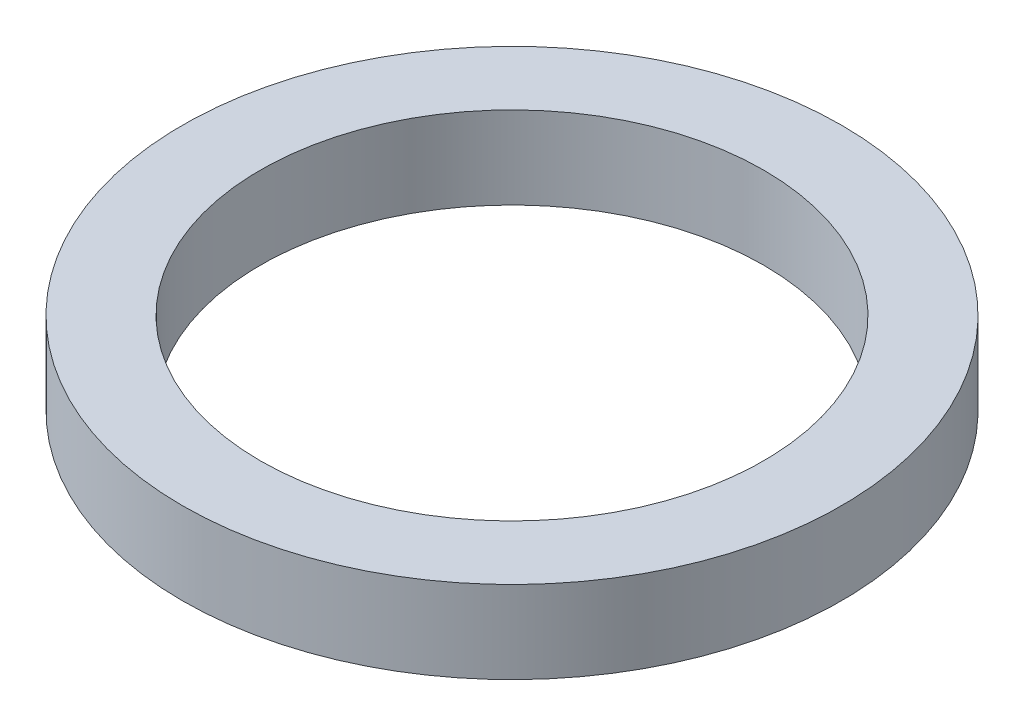
from build123d import *

# Parameters (mm, degrees)
SKETCH1_R           = 36
SKETCH1_R_2         = 27.5
BOSS_EXTRUDE1_DEPTH = 4.5


with BuildPart() as part:
    # Sketch1 → Boss-Extrude1 (new, symmetric)
    with BuildSketch(Plane(origin=(0, 0, 0), x_dir=(1, 0, 0), z_dir=(0, 1, 0))):
        with Locations(Location((0, 0, 0), (0, 0, 270))):
            Circle(SKETCH1_R)
        with Locations(Location((0, 0, 0), (0, 0, 270))):
            Circle(SKETCH1_R_2, mode=Mode.SUBTRACT)
    extrude(amount=BOSS_EXTRUDE1_DEPTH, both=True)


solid = part.part
